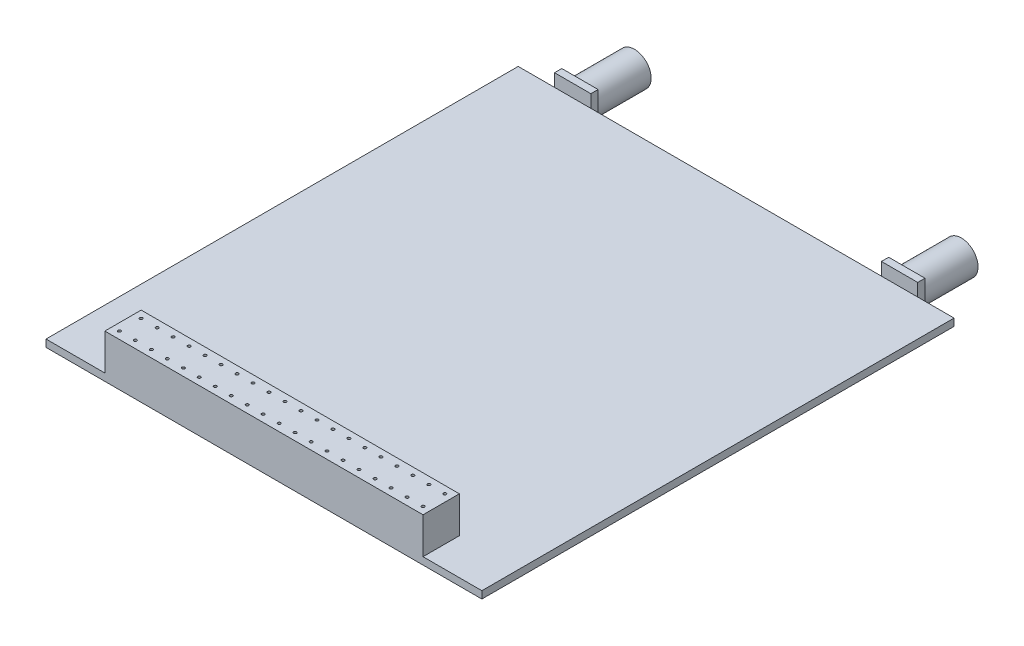
from build123d import *

# Parameters (mm, degrees)
SKETCH_1_W                  = 60
SKETCH_1_H                  = 65
EXTRUDE_1_DEPTH             = 1
SKETCH_7_W                  = 43.8
SKETCH_7_H                  = 5
EXTRUDE_3_DEPTH             = 5
SKETCH_8_R                  = 0.2
CUT_EXTRUDE_2_DEPTH         = 5
PATTERN_LINEAR_1_COUNT      = 20
PATTERN_LINEAR_1_PITCH      = 2.2
PATTERN_LINEAR_1_COUNT_DIR2 = 2
PATTERN_LINEAR_1_PITCH_DIR2 = 3
SKETCH_9_W                  = 5
SKETCH_9_H                  = 5
EXTRUDE_4_DEPTH             = 1
SKETCH_10_R                 = 2.3
EXTRUDE_5_DEPTH             = 7.5
SKETCH_11_R                 = 2.2
CUT_EXTRUDE_3_DEPTH         = 7.5
PATTERN_LINEAR_2_COUNT      = 2
PATTERN_LINEAR_2_PITCH      = 45


with BuildPart() as part:
    # 草图1 → 凸台-拉伸1 (new body)
    with BuildSketch(Plane(origin=(0, 0, 0), x_dir=(1, 0, 0), z_dir=(0, 1, 0))):
        with Locations((-31.923076923, -0.769230769)):
            Rectangle(SKETCH_1_W, SKETCH_1_H)
    extrude(amount=EXTRUDE_1_DEPTH)

    # 草图7 → 凸台-拉伸3 (add)
    with BuildSketch(Plane(origin=(0, 1, 0), x_dir=(1, 0, 0), z_dir=(0, 1, 0))):
        with Locations((-31.923076923, -30.769230769)):
            Rectangle(SKETCH_7_W, SKETCH_7_H)
    extrude(amount=EXTRUDE_3_DEPTH)

    # 草图8 → 切除-拉伸2 (cut)
    with BuildSketch(Plane(origin=(0, 6, 0), x_dir=(1, 0, 0), z_dir=(0, 1, 0))):
        with Locations(Location((-52.823076923, -29.269230769, 0), (0, 0, 270))):
            Circle(SKETCH_8_R)
    cut_extrude_2 = extrude(amount=-CUT_EXTRUDE_2_DEPTH, mode=Mode.SUBTRACT)

    # 阵列(线性)1: Cut-Extrude 2 20 × 2
    with Locations(*[(i * PATTERN_LINEAR_1_PITCH, 0, j * PATTERN_LINEAR_1_PITCH_DIR2) for i in range(PATTERN_LINEAR_1_COUNT) for j in range(PATTERN_LINEAR_1_COUNT_DIR2) if (i, j) != (0, 0)]):
        add(cut_extrude_2, mode=Mode.SUBTRACT)

    # 草图9 → 凸台-拉伸4 (add)
    with BuildSketch(Plane(origin=(0, 0, -31.730769231), x_dir=(-1, 0, 0), z_dir=(0, 0, -1))):
        with Locations((9.423076923, 0.25)):
            Rectangle(SKETCH_9_W, SKETCH_9_H)
    extrude_4 = extrude(amount=EXTRUDE_4_DEPTH)

    # 草图10 → 凸台-拉伸5 (add)
    with BuildSketch(Plane(origin=(0, 0, -32.730769231), x_dir=(-1, 0, 0), z_dir=(0, 0, -1))):
        with Locations((9.423076923, 0.25)):
            Circle(SKETCH_10_R)
    extrude_5 = extrude(amount=EXTRUDE_5_DEPTH)

    # 草图11 → 切除-拉伸3 (cut)
    with BuildSketch(Plane(origin=(0, 0, -40.230769231), x_dir=(-1, 0, 0), z_dir=(0, 0, -1))):
        with Locations((9.423076923, 0.25)):
            Circle(SKETCH_11_R)
    cut_extrude_3 = extrude(amount=-CUT_EXTRUDE_3_DEPTH, mode=Mode.SUBTRACT)

    # 阵列(线性)2: 凸台-拉伸4, 凸台-拉伸5, 切除-拉伸3 ×2
    with Locations(*[(-i * PATTERN_LINEAR_2_PITCH, 0, 0) for i in range(1, PATTERN_LINEAR_2_COUNT)]):
        add(extrude_4)
        add(extrude_5)
        add(cut_extrude_3, mode=Mode.SUBTRACT)


solid = part.part
